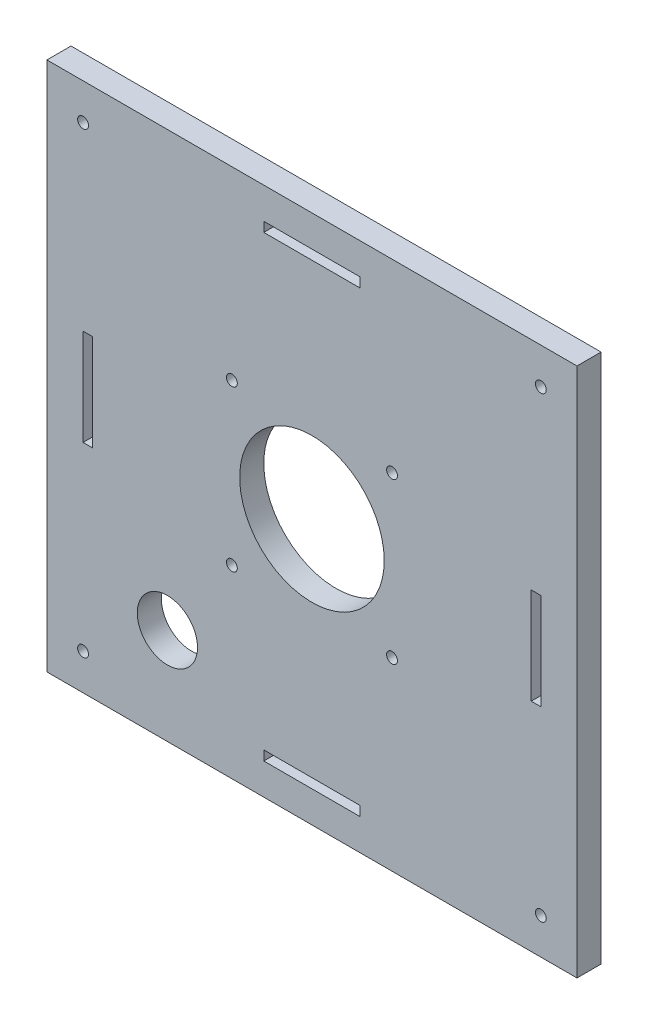
from build123d import *

# Parameters (mm, degrees)
SK_PLACA_W                         = 220
SK_PLACA_H                         = 220
PLACA_DEPTH                        = 10
SK_PASO_CABLES_R                   = 30
PASO_CABLES_DEPTH                  = 10
SK_PASANTES_M4_PEDESTAL_R          = 2.25
PASANTES_M4_PEDESTAL_DEPTH         = 10
SK_CAJAS_M4_INFERIORES_R           = 4
CAJAS_M4_INFERIORES_DEPTH          = 4.5
SK_PASANTES_M4_SEPARADORES_CAJA_R  = 2.25
PASANTES_M4_SEPARADORES_CAJA_DEPTH = 10
SK_PASO_CABLES_CAJA_R              = 12.5
PASO_CABLES_CAJA_DEPTH             = 10
CROQUIS1_W                         = 40
CROQUIS1_H                         = 4
CROQUIS1_W_2                       = 4
CROQUIS1_H_2                       = 40
CORTAR_EXTRUIR1_DEPTH              = 156.884572681


with BuildPart() as part:
    # Sk_Placa → Placa (new body)
    with BuildSketch(Plane.XY):
        Rectangle(SK_PLACA_W, SK_PLACA_H)
    extrude(amount=PLACA_DEPTH)

    # Sk_Paso_cables → Paso_cables (cut)
    with BuildSketch(Plane.XY):
        Circle(SK_PASO_CABLES_R)
    extrude(amount=PASO_CABLES_DEPTH, mode=Mode.SUBTRACT)

    # Sk_Pasantes_M4_pedestal → Pasantes_M4_pedestal (cut)
    with BuildSketch(Plane.XY):
        with Locations((33.234018716, 33.234018716)):
            Circle(SK_PASANTES_M4_PEDESTAL_R)
        with Locations((-33.234018716, 33.234018716)):
            Circle(SK_PASANTES_M4_PEDESTAL_R)
        with Locations((-33.234018716, -33.234018716)):
            Circle(SK_PASANTES_M4_PEDESTAL_R)
        with Locations((33.234018716, -33.234018716)):
            Circle(SK_PASANTES_M4_PEDESTAL_R)
    extrude(amount=PASANTES_M4_PEDESTAL_DEPTH, mode=Mode.SUBTRACT)

    # Sk_Cajas_M4_inferiores → Cajas_M4_inferiores (cut)
    with BuildSketch(Plane.XY):
        with Locations((33.234018716, 33.234018716)):
            Circle(SK_CAJAS_M4_INFERIORES_R)
        with Locations((-33.234018716, 33.234018716)):
            Circle(SK_CAJAS_M4_INFERIORES_R)
        with Locations((-33.234018716, -33.234018716)):
            Circle(SK_CAJAS_M4_INFERIORES_R)
        with Locations((33.234018716, -33.234018716)):
            Circle(SK_CAJAS_M4_INFERIORES_R)
    extrude(amount=CAJAS_M4_INFERIORES_DEPTH, mode=Mode.SUBTRACT)

    # Sk_Pasantes_M4_separadores_caja → Pasantes_M4_separadores_caja (cut)
    with BuildSketch(Plane.XY):
        with Locations((-95, -95)):
            Circle(SK_PASANTES_M4_SEPARADORES_CAJA_R)
        with Locations((-95, 95)):
            Circle(SK_PASANTES_M4_SEPARADORES_CAJA_R)
        with Locations((95, -95)):
            Circle(SK_PASANTES_M4_SEPARADORES_CAJA_R)
        with Locations((95, 95)):
            Circle(SK_PASANTES_M4_SEPARADORES_CAJA_R)
    extrude(amount=PASANTES_M4_SEPARADORES_CAJA_DEPTH, mode=Mode.SUBTRACT)

    # Sk_Paso_cables_caja → Paso_cables_caja (cut)
    with BuildSketch(Plane.XY):
        with Locations((-60, -70)):
            Circle(SK_PASO_CABLES_CAJA_R)
    extrude(amount=PASO_CABLES_CAJA_DEPTH, mode=Mode.SUBTRACT)

    # Croquis1 → Cortar-Extruir1 (cut, through all)
    with BuildSketch(Plane.XY.offset(10)):
        with Locations((0, -95)):
            Rectangle(CROQUIS1_W, CROQUIS1_H)
        with Locations((0, 95)):
            Rectangle(CROQUIS1_W, CROQUIS1_H)
        with Locations((93, 0)):
            Rectangle(CROQUIS1_W_2, CROQUIS1_H_2)
        with Locations((-93, 0)):
            Rectangle(CROQUIS1_W_2, CROQUIS1_H_2)
    extrude(amount=-CORTAR_EXTRUIR1_DEPTH, mode=Mode.SUBTRACT)


solid = part.part
